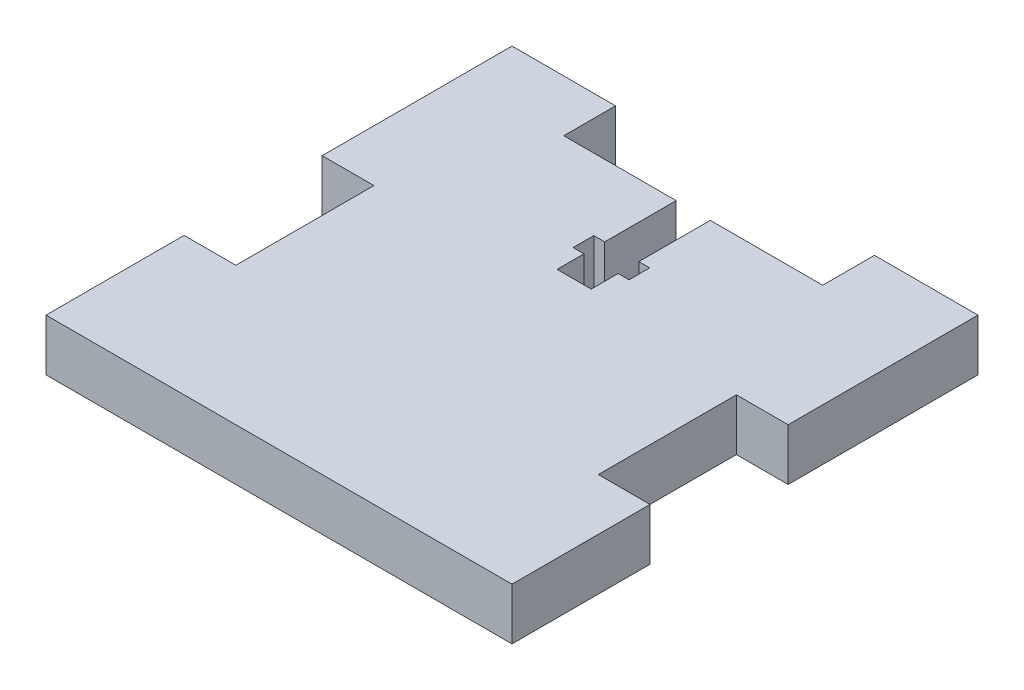
from build123d import *

# Parameters (mm, degrees)
SKETCH1_W                = 44.45
SKETCH1_H                = 6.35
BOSS_EXTRUDE1_DEPTH      = 50.8
BOSS_EXTRUDE2_DEPTH      = 6.35
BOSS_EXTRUDE2_DEPTH_BACK = 50.8
SKETCH2_W                = 16.933333333
SKETCH2_H                = 6.35
SKETCH4_W                = 12.7
SKETCH4_H                = 6.35
BOSS_EXTRUDE4_DEPTH      = 6.35
CUT_EXTRUDE1_DEPTH       = 59.630138368


with BuildPart() as part:
    # Sketch1 → Boss-Extrude1 (new body)
    with BuildSketch(Plane.XY):
        with Locations((0, -17.4625)):
            Rectangle(SKETCH1_W, SKETCH1_H)
    extrude(amount=BOSS_EXTRUDE1_DEPTH)

    # Sketch2 → Boss-Extrude2 (add, two sides: drawn at the far end of the back side and taken through both)
    with BuildSketch(Plane.ZY.offset(22.225).offset(-BOSS_EXTRUDE2_DEPTH_BACK)):
        with Locations((42.333333334, -17.4625)):
            Rectangle(SKETCH2_W, SKETCH2_H)
        with Locations((8.466666667, -17.4625)):
            Rectangle(SKETCH2_W, SKETCH2_H)
    extrude(amount=BOSS_EXTRUDE2_DEPTH + BOSS_EXTRUDE2_DEPTH_BACK)

    # Sketch4 → Boss-Extrude4 (add)
    with BuildSketch(Plane(origin=(0, 0, 0), x_dir=(-1, 0, 0), z_dir=(0, 0, -1))):
        with Locations((22.225, -17.4625)):
            Rectangle(SKETCH4_W, SKETCH4_H)
        with Locations((-22.225, -17.4625)):
            Rectangle(SKETCH4_W, SKETCH4_H)
    extrude(amount=BOSS_EXTRUDE4_DEPTH)

    # Sketch5 → Cut-Extrude1 (cut, through all)
    with BuildSketch(Plane(origin=(0, -20.6375, 0), x_dir=(-1, 0, 0), z_dir=(0, -1, 0))):
        Polygon((2.0955, 0), (-2.0955, 0), (-2.0955, -8.763), (-3.429, -8.763), (-3.429, -11.303), (-2.0955, -11.303), (-2.0955, -14.605), (2.0955, -14.605), (2.0955, -11.303), (3.429, -11.303), (3.429, -8.763), (2.0955, -8.763), align=None)
    extrude(amount=-CUT_EXTRUDE1_DEPTH, mode=Mode.SUBTRACT)


solid = part.part
